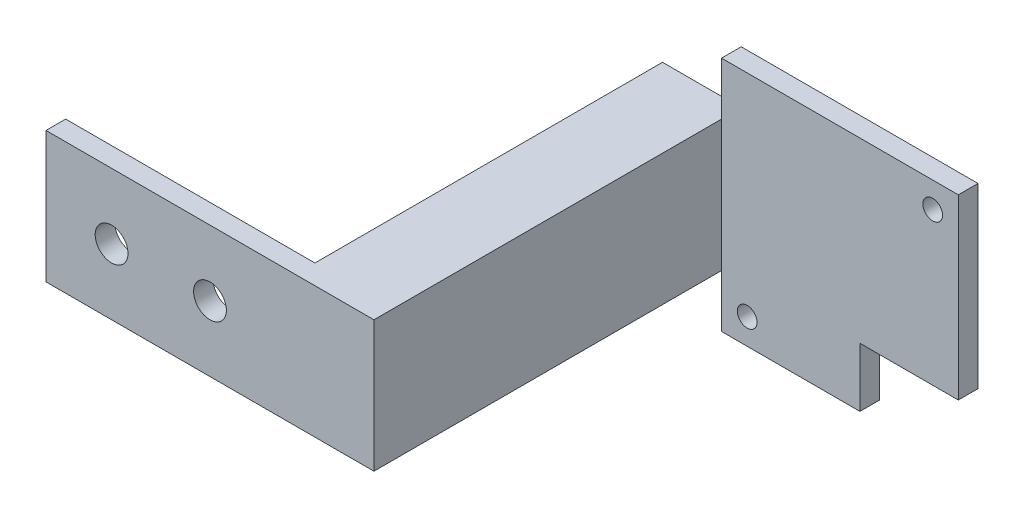
from build123d import *

# Parameters (mm, degrees)
SKETCH_1_W          = 36.1
SKETCH_1_H          = 36.1
EXTRUDE_1_DEPTH     = 3
SKETCH_2_R          = 1.5
CUT_EXTRUDE_1_DEPTH = 3
SKETCH_3_W          = 15
SKETCH_3_H          = 9
CUT_EXTRUDE_2_DEPTH = 3
SKETCH_4_W          = 12
SKETCH_4_H          = 10
EXTRUDE_2_DEPTH     = 3
SKETCH_5_W          = 12
SKETCH_5_H          = 20
EXTRUDE_3_DEPTH     = 50
SKETCH_7_W          = 50
SKETCH_7_H          = 20
EXTRUDE_4_DEPTH     = 3
SKETCH_9_R          = 2.5
CUT_EXTRUDE_4_DEPTH = 3


with BuildPart() as part:
    # 草图1 → 凸台-拉伸1 (new body)
    with BuildSketch(Plane.XY):
        Rectangle(SKETCH_1_W, SKETCH_1_H)
    extrude(amount=EXTRUDE_1_DEPTH)

    # 草图2 → 切除-拉伸1 (cut)
    with BuildSketch(Plane.XY.offset(3)):
        with Locations((14.142135624, 14.142135624)):
            Circle(SKETCH_2_R)
        with Locations(Location((-14.142135624, -14.142135624, 0), (0, 0, 180))):
            Circle(SKETCH_2_R)
    extrude(amount=-CUT_EXTRUDE_1_DEPTH, mode=Mode.SUBTRACT)

    # 草图3 → 切除-拉伸2 (cut)
    with BuildSketch(Plane.XY.offset(3)):
        with Locations((10.55, -13.55)):
            Rectangle(SKETCH_3_W, SKETCH_3_H)
    extrude(amount=-CUT_EXTRUDE_2_DEPTH, mode=Mode.SUBTRACT)

    # 草图4 → 凸台-拉伸2 (add)
    with BuildSketch(Plane.XY.offset(3)):
        with Locations((-24.05, 5)):
            Rectangle(SKETCH_4_W, SKETCH_4_H)
        with Locations((-24.05, -5)):
            Rectangle(SKETCH_4_W, SKETCH_4_H)
    extrude(amount=-EXTRUDE_2_DEPTH)

    # 草图5 → 凸台-拉伸3 (add)
    with BuildSketch(Plane.XY.offset(3)):
        with Locations((-24.05, 0)):
            Rectangle(SKETCH_5_W, SKETCH_5_H)
    extrude(amount=EXTRUDE_3_DEPTH)

    # 草图7 → 凸台-拉伸4 (add)
    with BuildSketch(Plane.XY.offset(53)):
        with Locations((-43.05, 0)):
            Rectangle(SKETCH_7_W, SKETCH_7_H)
    extrude(amount=EXTRUDE_4_DEPTH)

    # 草图9 → 切除-拉伸4 (cut)
    with BuildSketch(Plane.XY.offset(56)):
        with Locations((-58.05, 0)):
            Circle(SKETCH_9_R)
        with Locations((-43.05, 0)):
            Circle(SKETCH_9_R)
    extrude(amount=-CUT_EXTRUDE_4_DEPTH, mode=Mode.SUBTRACT)


solid = part.part
